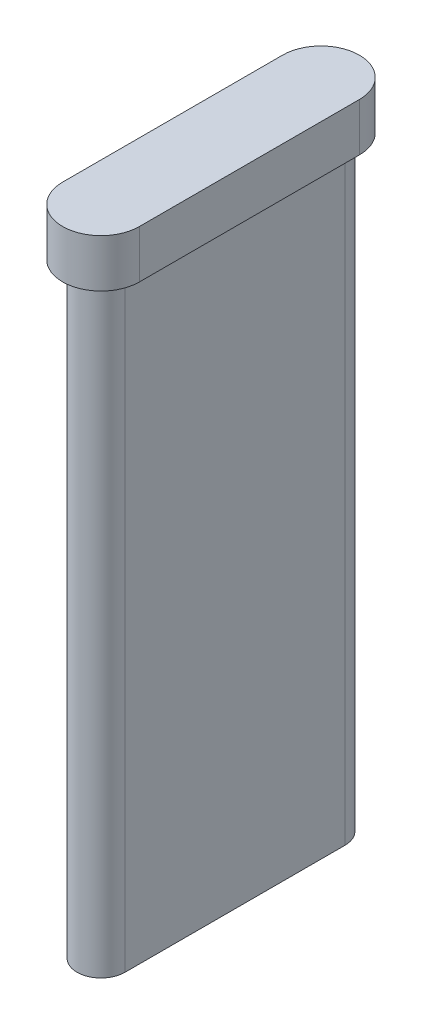
from build123d import *

# Parameters (mm, degrees)
BOSS_EXTRUDE1_DEPTH = 68
BOSS_EXTRUDE2_DEPTH = 5


with BuildPart() as part:
    # Sketch1 → Boss-Extrude1 (new body)
    with BuildSketch(Plane(origin=(0, 0, 0), x_dir=(1, 0, 0), z_dir=(0, 1, 0))):
        with BuildLine():
            Line((-2.5, -11.45), (-2.5, 11.45))
            ThreePointArc((-2.5, 11.45), (0, 13.95), (2.5, 11.45))
            Line((2.5, 11.45), (2.5, -11.45))
            ThreePointArc((2.5, -11.45), (0, -13.95), (-2.5, -11.45))
        make_face()
    extrude(amount=-BOSS_EXTRUDE1_DEPTH)

    # Sketch2 → Boss-Extrude2 (add)
    with BuildSketch(Plane(origin=(0, 0, 0), x_dir=(1, 0, 0), z_dir=(0, 1, 0))):
        with BuildLine():
            Line((4, -11.45), (4, 11.45))
            ThreePointArc((4, 11.45), (0, 15.45), (-4, 11.45))
            Line((-4, 11.45), (-4, -11.45))
            ThreePointArc((-4, -11.45), (0, -15.45), (4, -11.45))
        make_face()
    extrude(amount=-BOSS_EXTRUDE2_DEPTH)


solid = part.part
